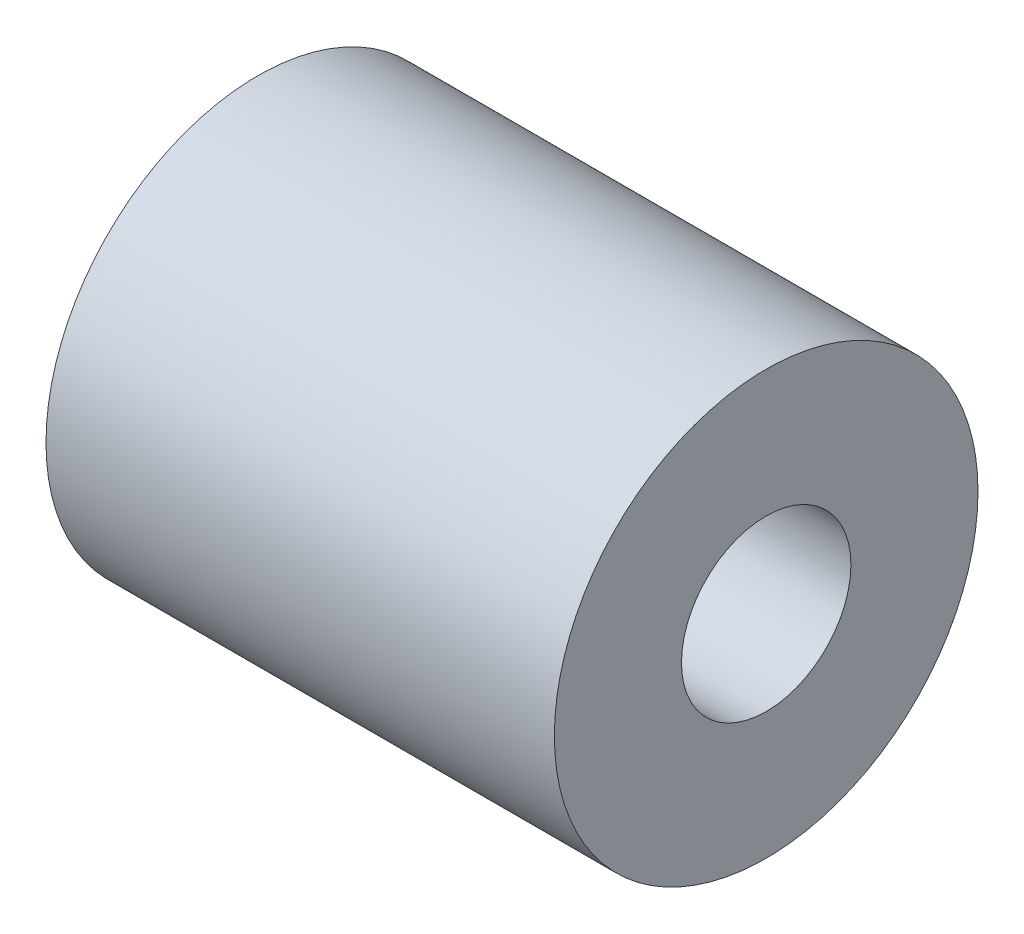
from build123d import *


with BuildPart() as part:
    # Sketch1 → Revolve1 (revolve)
    with BuildSketch(Plane.XY, mode=Mode.PRIVATE) as revolve1_sk:
        Polygon((0, 10), (24, 10), (24, 4), (12, 4), (12, 2.5), (0, 2.5), align=None)
    revolve(revolve1_sk.sketch.rotate(Axis((0, 0, 0), (1, 0, 0)), 90), axis=Axis((0, 0, 0), (1, 0, 0)))


solid = part.part
